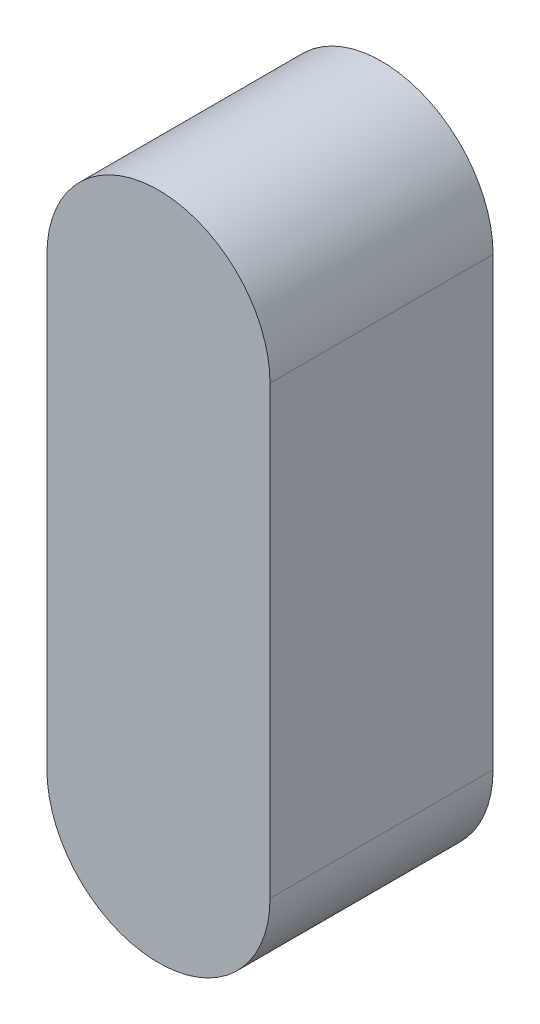
from build123d import *

# Parameters (mm, degrees)
DODANIE_WYCI_GNI_CIE1_DEPTH = 5


with BuildPart() as part:
    # Szkic1 → Dodanie-wyciągnięcie1 (new body)
    with BuildSketch(Plane.XY):
        with BuildLine():
            Line((-2.5, 0), (-2.5, 10))
            ThreePointArc((-2.5, 10), (0, 12.5), (2.5, 10))
            Line((2.5, 10), (2.5, 0))
            ThreePointArc((2.5, 0), (0, -2.5), (-2.5, 0))
        make_face()
    extrude(amount=DODANIE_WYCI_GNI_CIE1_DEPTH)


solid = part.part
